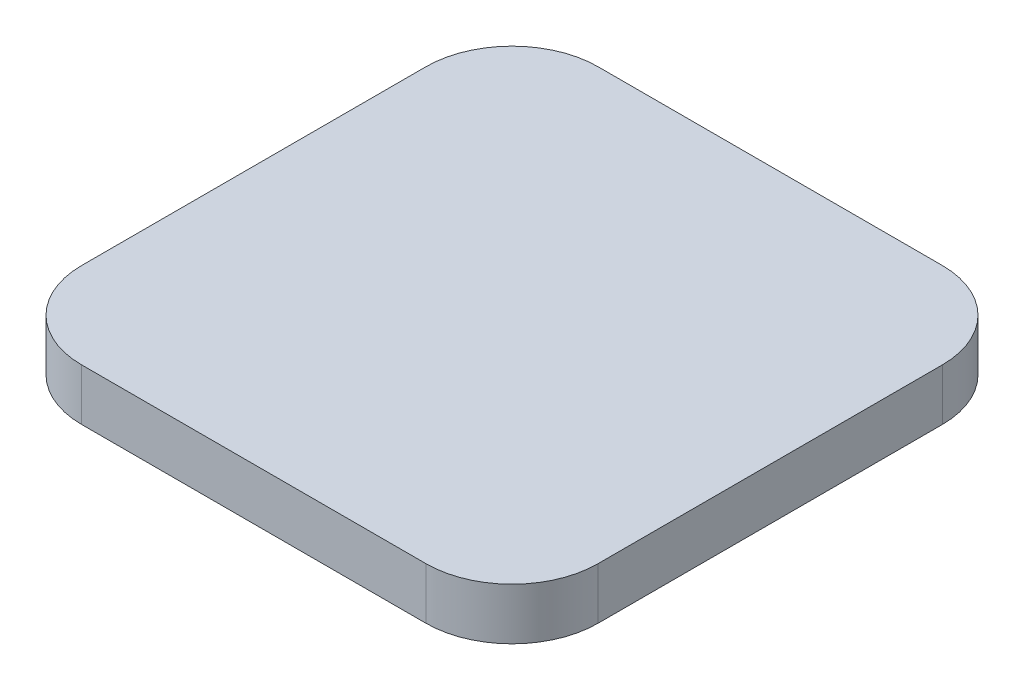
from build123d import *

# Parameters (mm, degrees)
BOSS_EXTRUDE1_DEPTH = 3


with BuildPart() as part:
    # Sketch1 → Boss-Extrude1 (new body)
    with BuildSketch(Plane(origin=(0, 0, 0), x_dir=(1, 0, 0), z_dir=(0, 1, 0))):
        with BuildLine():
            Line((-10, -15), (10, -15))
            ThreePointArc((10, -15), (13.535533906, -13.535533906), (15, -10))
            Line((15, -10), (15, 10))
            ThreePointArc((15, 10), (13.535533906, 13.535533906), (10, 15))
            Line((10, 15), (-10, 15))
            ThreePointArc((-10, 15), (-13.535533906, 13.535533906), (-15, 10))
            Line((-15, 10), (-15, -10))
            ThreePointArc((-15, -10), (-13.535533906, -13.535533906), (-10, -15))
        make_face()
    extrude(amount=BOSS_EXTRUDE1_DEPTH)


solid = part.part
